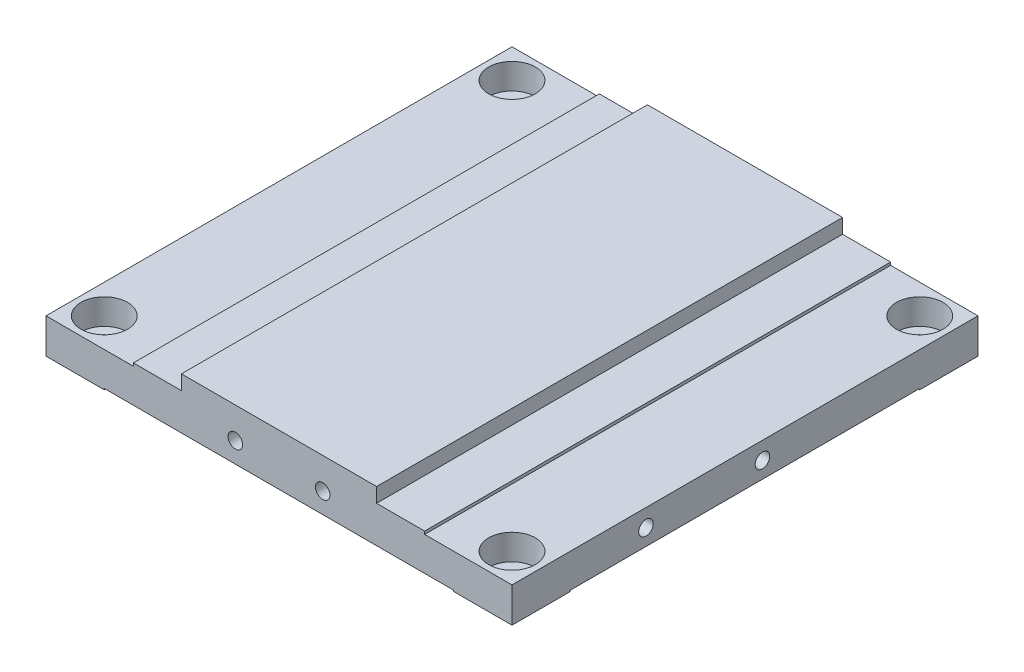
from build123d import *

# Parameters (mm, degrees)
SKETCH_1_W                  = 80
SKETCH_1_H                  = 80
EXTRUDE_1_DEPTH             = 9
SKETCH_2_W                  = 23.25
SKETCH_2_H                  = 2.5
CUT_EXTRUDE_1_DEPTH         = 90.894382472
SKETCH_10_W                 = 15
SKETCH_10_H                 = 0.5
CUT_EXTRUDE_3_DEPTH         = 90.894382472
HOLE_WIZARD_1_D             = 4.5
HOLE_WIZARD_1_CBORE_D       = 8
HOLE_WIZARD_1_CBORE_DEPTH   = 4.4
HOLE_WIZARD_M3_1_D          = 2.5
HOLE_WIZARD_M3_1_DEPTH      = 7.5
HOLE_WIZARD_M3_1_TIP        = 0.751075774
HOLE_WIZARD_M3_2_D          = 2.5
HOLE_WIZARD_M3_2_DEPTH      = 7.5
HOLE_WIZARD_M3_2_TIP        = 0.751075774
SKETCH_5_OUTSIDE_W          = 104.698
SKETCH_5_OUTSIDE_H          = 104.698
SKETCH_5_OUTSIDE_W_2        = 10
SKETCH_5_OUTSIDE_H_2        = 10
CUT_EXTRUDE_2_DEPTH         = 0.2
HOLE_WIZARD_M3_3_AT_2_COUNT = 2
HOLE_WIZARD_M3_3_AT_2_PITCH = 15


with BuildPart() as part:
    # 草图1 → 凸台-拉伸1 (new body)
    with BuildSketch(Plane(origin=(0, 0, 0), x_dir=(1, 0, 0), z_dir=(0, 1, 0))):
        Rectangle(SKETCH_1_W, SKETCH_1_H)
    extrude(amount=EXTRUDE_1_DEPTH)

    # 草图2 → 切除-拉伸1 (cut, through all)
    with BuildSketch(Plane.XY.offset(40)):
        with Locations((28.375, 7.75)):
            Rectangle(SKETCH_2_W, SKETCH_2_H)
        with Locations((-28.375, 7.75)):
            Rectangle(SKETCH_2_W, SKETCH_2_H)
    extrude(amount=-CUT_EXTRUDE_1_DEPTH, mode=Mode.SUBTRACT)

    # 草图10 → 切除-拉伸3 (cut, through all)
    with BuildSketch(Plane.XY.offset(40)):
        with Locations((32.5, 6.25)):
            Rectangle(SKETCH_10_W, SKETCH_10_H)
        with Locations((-32.5, 6.25)):
            Rectangle(SKETCH_10_W, SKETCH_10_H)
    extrude(amount=-CUT_EXTRUDE_3_DEPTH, mode=Mode.SUBTRACT)

    # 打孔尺寸根据内六角圆柱头螺钉的类型1 (through all)
    with Locations(Plane(origin=(-39.335611713, 6, 5.280516917), x_dir=(1, 0, 0), z_dir=(0, 1, 0))):
        with Locations((4.335611713, 40.280516917), (74.335611713, 40.280516917), (74.335611713, -29.719483083), (4.335611713, -29.719483083)):
            CounterBoreHole(HOLE_WIZARD_1_D / 2, HOLE_WIZARD_1_CBORE_D / 2, HOLE_WIZARD_1_CBORE_DEPTH)

    # M3 螺纹孔1
    with Locations(Plane.ZY.offset(40)):
        with Locations((7, 3), (-13, 3)):
            Hole(HOLE_WIZARD_M3_1_D / 2, depth=HOLE_WIZARD_M3_1_DEPTH)
            with Locations((0, 0, -(HOLE_WIZARD_M3_1_DEPTH + HOLE_WIZARD_M3_1_TIP / 2))):  # 118° drill point
                Cone(0, HOLE_WIZARD_M3_1_D / 2, HOLE_WIZARD_M3_1_TIP, mode=Mode.SUBTRACT)

    # M3 螺纹孔2
    with Locations(Plane(origin=(40, 0, 0), x_dir=(0, 0, -1), z_dir=(1, 0, 0))):
        with Locations((3, 3), (-17, 3)):
            Hole(HOLE_WIZARD_M3_2_D / 2, depth=HOLE_WIZARD_M3_2_DEPTH)
            with Locations((0, 0, -(HOLE_WIZARD_M3_2_DEPTH + HOLE_WIZARD_M3_2_TIP / 2))):  # 118° drill point
                Cone(0, HOLE_WIZARD_M3_2_D / 2, HOLE_WIZARD_M3_2_TIP, mode=Mode.SUBTRACT)

    # 草图5 outside → 切除-拉伸2 (cut)
    with BuildSketch(Plane.XZ):
        Rectangle(SKETCH_5_OUTSIDE_W, SKETCH_5_OUTSIDE_H)
        with Locations((35, 35)):
            Rectangle(SKETCH_5_OUTSIDE_W_2, SKETCH_5_OUTSIDE_H_2, mode=Mode.SUBTRACT)
        with Locations((-35, 35)):
            Rectangle(SKETCH_5_OUTSIDE_W_2, SKETCH_5_OUTSIDE_H_2, mode=Mode.SUBTRACT)
        with Locations((35, -35)):
            Rectangle(SKETCH_5_OUTSIDE_W_2, SKETCH_5_OUTSIDE_H_2, mode=Mode.SUBTRACT)
        with Locations((-35, -35)):
            Rectangle(SKETCH_5_OUTSIDE_W_2, SKETCH_5_OUTSIDE_H_2, mode=Mode.SUBTRACT)
    extrude(amount=-CUT_EXTRUDE_2_DEPTH, mode=Mode.SUBTRACT)

    # 草图11 → M3 螺纹孔3 (revolve, cut)
    with BuildSketch(Plane(origin=(-7.5, 3.7, 40), x_dir=(0, -1, 0), z_dir=(1, 0, 0))):
        Polygon((0, 0), (0, 8.251075774), (1.25, 7.5), (1.25, 0), align=None)
    hole_wizard_m3_3 = revolve(axis=Axis((-7.5, 3.7, 46.35), (0, 0, -1)), mode=Mode.SUBTRACT)

    # M3 螺纹孔3 at 2: M3 螺纹孔3 ×2
    with Locations(*[(i * HOLE_WIZARD_M3_3_AT_2_PITCH, 0, 0) for i in range(1, HOLE_WIZARD_M3_3_AT_2_COUNT)]):
        add(hole_wizard_m3_3, mode=Mode.SUBTRACT)

    # 镜向1: M3 螺纹孔3 across plane
    add(hole_wizard_m3_3.mirror(Plane.XY), mode=Mode.SUBTRACT)

    # 镜向1 copy 1 sketch → 镜向1 copy 1 (revolve, cut)
    with BuildSketch(Plane(origin=(7.5, 3.7, -40), x_dir=(0, -1, 0), z_dir=(1, 0, 0))):
        Polygon((0, 0), (0, -8.251075774), (1.25, -7.5), (1.25, 0), align=None)
    revolve(axis=Axis((7.5, 3.7, -46.35), (0, 0, -1)), mode=Mode.SUBTRACT)


solid = part.part
